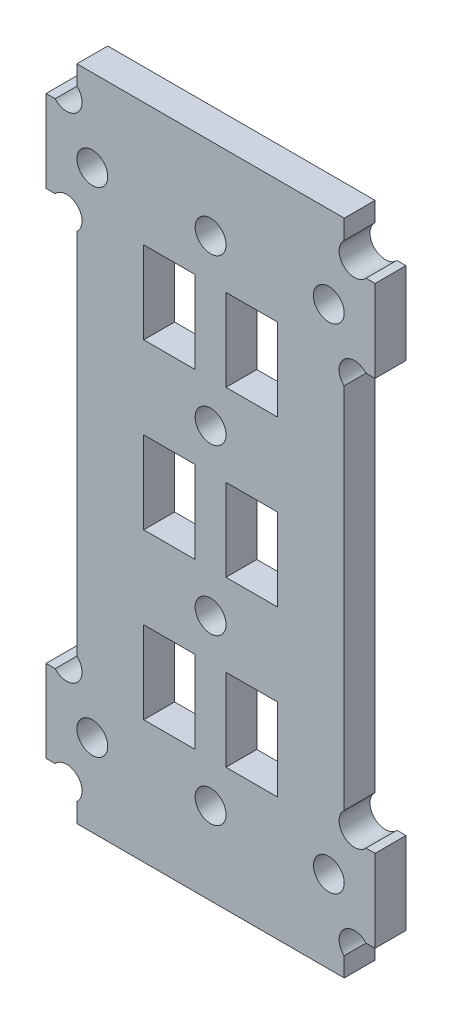
from build123d import *

# Parameters (mm, degrees)
SKETCH_1_W                = 32
SKETCH_1_H                = 64
EXTRUDE_1_DEPTH           = 3
SKETCH_2_W                = 2.5
SKETCH_2_H                = 4
CUT_EXTRUDE_1_DEPTH       = 36.902646142
MIRROR_2_COPY_1_SKETCH_W  = 2.5
MIRROR_2_COPY_1_SKETCH_H  = 4
MIRROR_2_COPY_1_DEPTH     = 36.902646142
SKETCH_4_W                = 3
SKETCH_4_H                = 8
CUT_EXTRUDE_3_DEPTH       = 10
SKETCH_6_W                = 3
SKETCH_6_H                = 4
CUT_EXTRUDE_5_DEPTH       = 36.902646142
MIRROR_9_COPY_1_SKETCH_W  = 3
MIRROR_9_COPY_1_SKETCH_H  = 4
MIRROR_9_COPY_1_DEPTH     = 36.902646142
SKETCH_8_R                = 1.5
CUT_EXTRUDE_6_DEPTH       = 36.902646142
MIRROR_11_COPY_1_SKETCH_R = 1.5
MIRROR_11_COPY_1_DEPTH    = 36.902646142
SKETCH_10_R               = 1.5
CUT_EXTRUDE_8_DEPTH       = 36.902646142
MIRROR_15_COPY_1_SKETCH_R = 1.5
MIRROR_15_COPY_1_DEPTH    = 36.902646142
SKETCH_11_R               = 1.5
CUT_EXTRUDE_9_DEPTH       = 36.902646142
MIRROR_17_COPY_1_SKETCH_R = 1.5
MIRROR_17_COPY_1_DEPTH    = 36.902646142
SKETCH_12_W               = 3
SKETCH_12_H               = 8
CUT_EXTRUDE_10_DEPTH      = 36.902646142
MIRROR_19_COPY_1_SKETCH_W = 3
MIRROR_19_COPY_1_SKETCH_H = 8
MIRROR_19_COPY_1_DEPTH    = 36.902646142
SKETCH_13_R               = 1.5
CUT_EXTRUDE_11_DEPTH      = 36.902646142
MIRROR_21_COPY_1_SKETCH_R = 1.5
MIRROR_21_COPY_1_DEPTH    = 36.902646142
SKETCH_14_W               = 5
SKETCH_14_H               = 8
CUT_EXTRUDE_12_DEPTH      = 36.902646142
SKETCH_15_R               = 1.5
CUT_EXTRUDE_13_DEPTH      = 36.902646142
EXTRUDE_START             = -3
SKETCH_16_R               = 1.5
EXTRUDE_2_DEPTH           = 3
SKETCH_17_R               = 1.5
EXTRUDE_3_DEPTH           = 3
SKETCH_18_W               = 3.452729718
SKETCH_18_H               = 30.432996322
SKETCH_18_W_2             = 3.815279569
CUT_EXTRUDE_14_DEPTH      = 36.902646142


with BuildPart() as part:
    # 草图1 → 凸台-拉伸1 (new body)
    with BuildSketch(Plane.XY):
        Rectangle(SKETCH_1_W, SKETCH_1_H)
    extrude(amount=EXTRUDE_1_DEPTH)

    # 草图2 → 切除-拉伸1 (cut, through all)
    with BuildSketch(Plane.XY.offset(3)):
        Polygon((4, 16), (4, 12), (6.5, 12), (6.5, 20), (1.5, 20), (1.5, 16), align=None)
        with Locations((2.75, 14)):
            Rectangle(SKETCH_2_W, SKETCH_2_H)
    cut_extrude_1 = extrude(amount=-CUT_EXTRUDE_1_DEPTH, mode=Mode.SUBTRACT)

    # 镜向1: 切除-拉伸1 across plane
    add(cut_extrude_1.mirror(Plane(origin=(0, 0, 0), x_dir=(0, 0, 1), z_dir=(1, 0, 0))), mode=Mode.SUBTRACT)

    # 镜向2: 切除-拉伸1 across plane
    add(cut_extrude_1.mirror(Plane.ZX), mode=Mode.SUBTRACT)

    # 镜向2 copy 1 sketch → 镜向2 copy 1 (cut, through all)
    with BuildSketch(Plane(origin=(0, 0, 3), x_dir=(-1, 0, 0), z_dir=(0, 0, 1))):
        Polygon((4, 16), (4, 12), (6.5, 12), (6.5, 20), (1.5, 20), (1.5, 16), align=None)
        with Locations((2.75, 14)):
            Rectangle(MIRROR_2_COPY_1_SKETCH_W, MIRROR_2_COPY_1_SKETCH_H)
    extrude(amount=-MIRROR_2_COPY_1_DEPTH, mode=Mode.SUBTRACT)

    # 草图4 → 切除-拉伸3 (cut)
    with BuildSketch(Plane.XY.offset(3)):
        with Locations((14.5, 0)):
            Rectangle(SKETCH_4_W, SKETCH_4_H)
    cut_extrude_3 = extrude(amount=-CUT_EXTRUDE_3_DEPTH, mode=Mode.SUBTRACT)

    # 镜向5: 切除-拉伸3 across plane
    add(cut_extrude_3.mirror(Plane(origin=(0, 0, 0), x_dir=(0, 0, 1), z_dir=(1, 0, 0))), mode=Mode.SUBTRACT)

    # 草图6 → 切除-拉伸5 (cut, through all)
    with BuildSketch(Plane.XY.offset(3)):
        with Locations((14.5, 30)):
            Rectangle(SKETCH_6_W, SKETCH_6_H)
    cut_extrude_5 = extrude(amount=-CUT_EXTRUDE_5_DEPTH, mode=Mode.SUBTRACT)

    # 镜向8: 切除-拉伸5 across plane
    add(cut_extrude_5.mirror(Plane.ZX), mode=Mode.SUBTRACT)

    # 镜向9: 切除-拉伸5 across plane
    add(cut_extrude_5.mirror(Plane(origin=(0, 0, 0), x_dir=(0, 0, 1), z_dir=(1, 0, 0))), mode=Mode.SUBTRACT)

    # 镜向9 copy 1 sketch → 镜向9 copy 1 (cut, through all)
    with BuildSketch(Plane(origin=(0, 0, 3), x_dir=(-1, 0, 0), z_dir=(0, 0, 1))):
        with Locations((14.5, 30)):
            Rectangle(MIRROR_9_COPY_1_SKETCH_W, MIRROR_9_COPY_1_SKETCH_H)
    extrude(amount=-MIRROR_9_COPY_1_DEPTH, mode=Mode.SUBTRACT)

    # 草图8 → 切除-拉伸6 (cut, through all)
    with BuildSketch(Plane.XY.offset(3)):
        with Locations((14, 29)):
            Circle(SKETCH_8_R)
    cut_extrude_6 = extrude(amount=-CUT_EXTRUDE_6_DEPTH, mode=Mode.SUBTRACT)

    # 镜向10: 切除-拉伸6 across plane
    add(cut_extrude_6.mirror(Plane(origin=(0, 0, 0), x_dir=(0, 0, 1), z_dir=(1, 0, 0))), mode=Mode.SUBTRACT)

    # 镜向11: 切除-拉伸6 across plane
    add(cut_extrude_6.mirror(Plane.ZX), mode=Mode.SUBTRACT)

    # 镜向11 copy 1 sketch → 镜向11 copy 1 (cut, through all)
    with BuildSketch(Plane(origin=(0, 0, 3), x_dir=(-1, 0, 0), z_dir=(0, 0, 1))):
        with Locations((14, 29)):
            Circle(MIRROR_11_COPY_1_SKETCH_R)
    extrude(amount=-MIRROR_11_COPY_1_DEPTH, mode=Mode.SUBTRACT)

    # 草图10 → 切除-拉伸8 (cut, through all)
    with BuildSketch(Plane.XY.offset(3)):
        with Locations((-14, 3)):
            Circle(SKETCH_10_R)
    cut_extrude_8 = extrude(amount=-CUT_EXTRUDE_8_DEPTH, mode=Mode.SUBTRACT)

    # 镜向14: 切除-拉伸8 across plane
    add(cut_extrude_8.mirror(Plane.ZX), mode=Mode.SUBTRACT)

    # 镜向15: 切除-拉伸8 across plane
    add(cut_extrude_8.mirror(Plane(origin=(0, 0, 0), x_dir=(0, 0, 1), z_dir=(1, 0, 0))), mode=Mode.SUBTRACT)

    # 镜向15 copy 1 sketch → 镜向15 copy 1 (cut, through all)
    with BuildSketch(Plane(origin=(0, 0, 3), x_dir=(-1, 0, 0), z_dir=(0, 0, 1))):
        with Locations((-14, 3)):
            Circle(MIRROR_15_COPY_1_SKETCH_R)
    extrude(amount=-MIRROR_15_COPY_1_DEPTH, mode=Mode.SUBTRACT)

    # 草图11 → 切除-拉伸9 (cut, through all)
    with BuildSketch(Plane.XY.offset(3)):
        with Locations((-11.5, 8)):
            Circle(SKETCH_11_R)
        with Locations((-11.5, 24)):
            Circle(SKETCH_11_R)
    cut_extrude_9 = extrude(amount=-CUT_EXTRUDE_9_DEPTH, mode=Mode.SUBTRACT)

    # 镜向16: 切除-拉伸9 across plane
    add(cut_extrude_9.mirror(Plane(origin=(0, 0, 0), x_dir=(0, 0, 1), z_dir=(1, 0, 0))), mode=Mode.SUBTRACT)

    # 镜向17: 切除-拉伸9 across plane
    add(cut_extrude_9.mirror(Plane.ZX), mode=Mode.SUBTRACT)

    # 镜向17 copy 1 sketch → 镜向17 copy 1 (cut, through all)
    with BuildSketch(Plane(origin=(0, 0, 3), x_dir=(-1, 0, 0), z_dir=(0, 0, 1))):
        with Locations((-11.5, 8)):
            Circle(MIRROR_17_COPY_1_SKETCH_R)
        with Locations((-11.5, 24)):
            Circle(MIRROR_17_COPY_1_SKETCH_R)
    extrude(amount=-MIRROR_17_COPY_1_DEPTH, mode=Mode.SUBTRACT)

    # 草图12 → 切除-拉伸10 (cut, through all)
    with BuildSketch(Plane(origin=(0, 0, 0), x_dir=(-1, 0, 0), z_dir=(0, 0, -1))):
        with Locations((-14.5, 16)):
            Rectangle(SKETCH_12_W, SKETCH_12_H)
    cut_extrude_10 = extrude(amount=-CUT_EXTRUDE_10_DEPTH, mode=Mode.SUBTRACT)

    # 镜向18: 切除-拉伸10 across plane
    add(cut_extrude_10.mirror(Plane(origin=(0, 0, 0), x_dir=(0, 0, 1), z_dir=(1, 0, 0))), mode=Mode.SUBTRACT)

    # 镜向19: 切除-拉伸10 across plane
    add(cut_extrude_10.mirror(Plane.ZX), mode=Mode.SUBTRACT)

    # 镜向19 copy 1 sketch → 镜向19 copy 1 (cut, through all)
    with BuildSketch(Plane(origin=(0, 0, 0), x_dir=(1, 0, 0), z_dir=(0, 0, -1))):
        with Locations((-14.5, 16)):
            Rectangle(MIRROR_19_COPY_1_SKETCH_W, MIRROR_19_COPY_1_SKETCH_H)
    extrude(amount=-MIRROR_19_COPY_1_DEPTH, mode=Mode.SUBTRACT)

    # 草图13 → 切除-拉伸11 (cut, through all)
    with BuildSketch(Plane(origin=(0, 0, 0), x_dir=(-1, 0, 0), z_dir=(0, 0, -1))):
        with Locations((-14, 19)):
            Circle(SKETCH_13_R)
        with Locations((-14, 13)):
            Circle(SKETCH_13_R)
    cut_extrude_11 = extrude(amount=-CUT_EXTRUDE_11_DEPTH, mode=Mode.SUBTRACT)

    # 镜向20: 切除-拉伸11 across plane
    add(cut_extrude_11.mirror(Plane(origin=(0, 0, 0), x_dir=(0, 0, 1), z_dir=(1, 0, 0))), mode=Mode.SUBTRACT)

    # 镜向21: 切除-拉伸11 across plane
    add(cut_extrude_11.mirror(Plane.ZX), mode=Mode.SUBTRACT)

    # 镜向21 copy 1 sketch → 镜向21 copy 1 (cut, through all)
    with BuildSketch(Plane(origin=(0, 0, 0), x_dir=(1, 0, 0), z_dir=(0, 0, -1))):
        with Locations((-14, 19)):
            Circle(MIRROR_21_COPY_1_SKETCH_R)
        with Locations((-14, 13)):
            Circle(MIRROR_21_COPY_1_SKETCH_R)
    extrude(amount=-MIRROR_21_COPY_1_DEPTH, mode=Mode.SUBTRACT)

    # 草图14 → 切除-拉伸12 (cut, through all)
    with BuildSketch(Plane(origin=(0, 0, 0), x_dir=(-1, 0, 0), z_dir=(0, 0, -1))):
        with Locations((4, 0)):
            Rectangle(SKETCH_14_W, SKETCH_14_H)
    cut_extrude_12 = extrude(amount=-CUT_EXTRUDE_12_DEPTH, mode=Mode.SUBTRACT)

    # 镜向22: 切除-拉伸12 across plane
    add(cut_extrude_12.mirror(Plane(origin=(0, 0, 0), x_dir=(0, 0, 1), z_dir=(1, 0, 0))), mode=Mode.SUBTRACT)

    # 草图15 → 切除-拉伸13 (cut, through all)
    with BuildSketch(Plane(origin=(0, 0, 0), x_dir=(-1, 0, 0), z_dir=(0, 0, -1))):
        with Locations((0, 8)):
            Circle(SKETCH_15_R)
        with Locations((0, 24)):
            Circle(SKETCH_15_R)
    cut_extrude_13 = extrude(amount=-CUT_EXTRUDE_13_DEPTH, mode=Mode.SUBTRACT)

    # 镜向23: 切除-拉伸13 across plane
    add(cut_extrude_13.mirror(Plane.ZX), mode=Mode.SUBTRACT)

    # 草图16 → 凸台-拉伸2 (add)
    with BuildSketch(Plane(origin=(0, 0, 0), x_dir=(-1, 0, 0), z_dir=(0, 0, -1)).offset(EXTRUDE_START)):
        with Locations((-11.5, 8)):
            Circle(SKETCH_16_R)
        with Locations((11.5, 8)):
            Circle(SKETCH_16_R)
        with Locations((11.5, -8)):
            Circle(SKETCH_16_R)
        with Locations((-11.5, -8)):
            Circle(SKETCH_16_R)
    extrude(amount=EXTRUDE_2_DEPTH)

    # 草图17 → 凸台-拉伸3 (add)
    with BuildSketch(Plane(origin=(0, 0, 0), x_dir=(-1, 0, 0), z_dir=(0, 0, -1))):
        with Locations((14, 13)):
            Circle(SKETCH_17_R)
        with Locations((-14, 13)):
            Circle(SKETCH_17_R)
        with Locations((-14, 3)):
            Circle(SKETCH_17_R)
        with Locations((14, 3)):
            Circle(SKETCH_17_R)
        with Locations((14, -3)):
            Circle(SKETCH_17_R)
        with Locations((-14, -3)):
            Circle(SKETCH_17_R)
        with Locations((-14, -13)):
            Circle(SKETCH_17_R)
        with Locations((14, -13)):
            Circle(SKETCH_17_R)
    extrude(amount=-EXTRUDE_3_DEPTH)

    # 草图18 → 切除-拉伸14 (cut, through all)
    with BuildSketch(Plane(origin=(0, 0, 0), x_dir=(-1, 0, 0), z_dir=(0, 0, -1))):
        with Locations((14.726364859, 0.092049044)):
            Rectangle(SKETCH_18_W, SKETCH_18_H)
        with Locations((-14.907639785, 0.092049044)):
            Rectangle(SKETCH_18_W_2, SKETCH_18_H)
    extrude(amount=-CUT_EXTRUDE_14_DEPTH, mode=Mode.SUBTRACT)


solid = part.part
